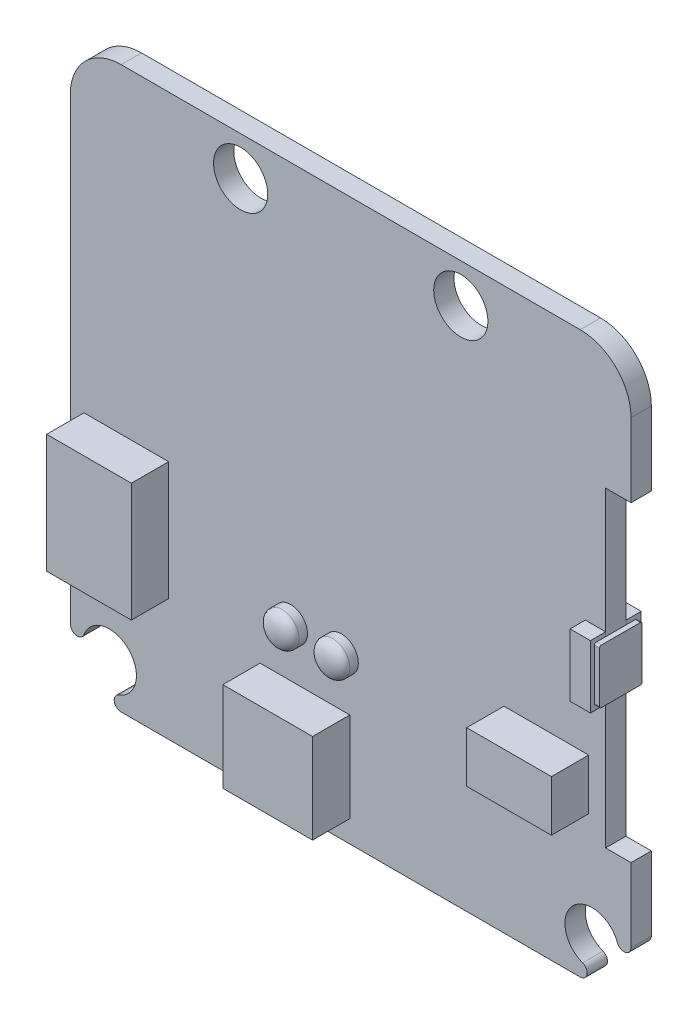
from build123d import *

# Parameters (mm, degrees)
EXTRUDE_1_DEPTH      = 1.2
CUT_EXTRUDE_START    = -1.2
SKETCH_2_R           = 1.6
CUT_EXTRUDE_1_DEPTH  = 1.2
SKETCH_3_W           = 1.5
SKETCH_3_H           = 18.4
CUT_EXTRUDE_2_DEPTH  = 1.2
EXTRUDE_2_DEPTH      = 0.9
EXTRUDE_2_DEPTH_BACK = 2.1
SKETCH_4_W           = 1.2
SKETCH_4_H           = 3.7
EXTRUDE_3_DEPTH      = 0.3
EXTRUDE_3_DEPTH_BACK = 0.5
SKETCH_6_W           = 5.3
SKETCH_6_H           = 5.3
EXTRUDE_4_DEPTH      = 2.2
SKETCH_6_W_2         = 5
SKETCH_6_H_2         = 7
EXTRUDE_4_2_DEPTH    = 2.2
SKETCH_6_H_3         = 3
EXTRUDE_4_3_DEPTH    = 2.2
SKETCH_7_R           = 1
EXTRUDE_5_DEPTH      = 0.5
EXTRUDE_5_2_DEPTH    = 0.5
DOME_1_FACE_RADIUS   = 1
DOME_1_HEIGHT        = 0.5
DOME_2_FACE_RADIUS   = 1
DOME_2_HEIGHT        = 0.5


with BuildPart() as part:
    # Эскиз1 → Бобышка-Вытянуть1 (new body)
    with BuildSketch(Plane.XY):
        with BuildLine():
            Line((-13.55, -16.55), (13.55, -16.55))
            ThreePointArc((13.55, -16.55), (15.671320344, -15.671320344), (16.55, -13.55))
            Line((16.55, -13.55), (16.55, 13.55))
            ThreePointArc((16.55, 13.55), (15.671320344, 15.671320344), (13.55, 16.55))
            Line((13.55, 16.55), (-13.55, 16.55))
            ThreePointArc((-13.55, 16.55), (-15.671320344, 15.671320344), (-16.55, 13.55))
            Line((-16.55, 13.55), (-16.55, -13.55))
            ThreePointArc((-16.55, -13.55), (-15.671320344, -15.671320344), (-13.55, -16.55))
        make_face()
    extrude(amount=EXTRUDE_1_DEPTH)

    # Эскиз2 → Вырез-Вытянуть1 (cut)
    with BuildSketch(Plane.XY.offset(1.2).offset(CUT_EXTRUDE_START)):
        with Locations((-6.5, 14.25)):
            Circle(SKETCH_2_R)
        with Locations((6.5, 14.25)):
            Circle(SKETCH_2_R)
        with BuildLine():
            ThreePointArc((-13.693566879, -15.750127389), (-13.11862915, -13.11862915), (-15.750127389, -13.693566879))
            ThreePointArc((-15.750127389, -13.693566879), (-16.210110036, -13.956327344), (-16.55, -13.55))
            ThreePointArc((-16.55, -13.55), (-15.671320344, -15.671320344), (-13.55, -16.55))
            ThreePointArc((-13.55, -16.55), (-13.956327344, -16.210110036), (-13.693566879, -15.750127389))
        make_face()
        with BuildLine():
            ThreePointArc((13.693566879, -15.750127389), (13.11862915, -13.11862915), (15.750127389, -13.693566879))
            ThreePointArc((15.750127389, -13.693566879), (16.210110036, -13.956327344), (16.55, -13.55))
            ThreePointArc((16.55, -13.55), (15.671320344, -15.671320344), (13.55, -16.55))
            ThreePointArc((13.55, -16.55), (13.956327344, -16.210110036), (13.693566879, -15.750127389))
        make_face()
    extrude(amount=CUT_EXTRUDE_1_DEPTH, mode=Mode.SUBTRACT)

    # Эскиз3 → Вырез-Вытянуть2 (cut)
    with BuildSketch(Plane.XY.offset(1.2)):
        with Locations((15.8, 0)):
            Rectangle(SKETCH_3_W, SKETCH_3_H)
    extrude(amount=-CUT_EXTRUDE_2_DEPTH, mode=Mode.SUBTRACT)


with BuildPart() as body_2:
    # Эскиз4 → Бобышка-Вытянуть2 (new, two sides: drawn at the far end of the back side and taken through both)
    with BuildSketch(Plane.XY.offset(1.2).offset(-EXTRUDE_2_DEPTH_BACK)):
        with Locations((14.45, 0)):
            Rectangle(SKETCH_4_W, SKETCH_4_H)
    extrude(amount=EXTRUDE_2_DEPTH + EXTRUDE_2_DEPTH_BACK)


with BuildPart() as body_3:
    # Эскиз5 → Бобышка-Вытянуть3 (new, two sides: drawn at the far end of the back side and taken through both)
    with BuildSketch(Plane(origin=(15.05, 0, 0), x_dir=(0, 0, -1), z_dir=(1, 0, 0)).offset(-EXTRUDE_3_DEPTH_BACK)):
        with BuildLine():
            Line((0.55, 1.6), (-1.75, 1.6))
            ThreePointArc((-1.75, 1.6), (-1.820710678, 1.570710678), (-1.85, 1.5))
            Line((-1.85, 1.5), (-1.85, -1.5))
            ThreePointArc((-1.85, -1.5), (-1.820710678, -1.570710678), (-1.75, -1.6))
            Line((-1.75, -1.6), (0.55, -1.6))
            ThreePointArc((0.55, -1.6), (0.620710678, -1.570710678), (0.65, -1.5))
            Line((0.65, -1.5), (0.65, 1.5))
            ThreePointArc((0.65, 1.5), (0.620710678, 1.570710678), (0.55, 1.6))
        make_face()
    extrude(amount=EXTRUDE_3_DEPTH + EXTRUDE_3_DEPTH_BACK)


with BuildPart() as body_4:
    # Эскиз6 → Бобышка-Вытянуть4 (new body)
    with BuildSketch(Plane.XY.offset(1.2)):
        with Locations((-2.7, -12.6)):
            Rectangle(SKETCH_6_W, SKETCH_6_H)
    extrude(amount=EXTRUDE_4_DEPTH)


with BuildPart() as body_5:
    # Эскиз6 → Extrude 4 2 (new body)
    with BuildSketch(Plane.XY.offset(1.2)):
        with Locations((-13.25, -5.85)):
            Rectangle(SKETCH_6_W_2, SKETCH_6_H_2)
    extrude(amount=EXTRUDE_4_2_DEPTH)


with BuildPart() as body_6:
    # Эскиз6 → Extrude 4 3 (new body)
    with BuildSketch(Plane.XY.offset(1.2)):
        with Locations((11.55, -6.45)):
            Rectangle(SKETCH_6_W_2, SKETCH_6_H_3)
    extrude(amount=EXTRUDE_4_3_DEPTH)


with BuildPart() as body_7:
    # Эскиз7 → Бобышка-Вытянуть5 (new body)
    with BuildSketch(Plane.XY.offset(1.2)):
        with Locations((-3.55, -7.05)):
            Circle(SKETCH_7_R)
    extrude(amount=EXTRUDE_5_DEPTH)

    # Купол2: an elliptical dome of height H over a round flat face of radius A is half a spheroid: the quarter ellipse of half axes A and H revolved about the face's axis
    with BuildSketch(Plane((-3.55, -7.05, 1.7), x_dir=(0, 1, 0), z_dir=(1, 0, 0)), mode=Mode.PRIVATE) as dome_2_quarter:
        Ellipse(DOME_2_FACE_RADIUS, DOME_2_HEIGHT)
        Rectangle(DOME_2_FACE_RADIUS, DOME_2_HEIGHT, align=(Align.MIN, Align.MIN), mode=Mode.INTERSECT)
    revolve(dome_2_quarter.sketch, axis=Axis((-3.55, -7.05, 1.7), (0, 0, 1)))


with BuildPart() as body_8:
    # Эскиз7 → Extrude 5 2 (new body)
    with BuildSketch(Plane.XY.offset(1.2)):
        with Locations((-0.55, -7.05)):
            Circle(SKETCH_7_R)
    extrude(amount=EXTRUDE_5_2_DEPTH)

    # Купол1: an elliptical dome of height H over a round flat face of radius A is half a spheroid: the quarter ellipse of half axes A and H revolved about the face's axis
    with BuildSketch(Plane((-0.55, -7.05, 1.7), x_dir=(0, 1, 0), z_dir=(1, 0, 0)), mode=Mode.PRIVATE) as dome_1_quarter:
        Ellipse(DOME_1_FACE_RADIUS, DOME_1_HEIGHT)
        Rectangle(DOME_1_FACE_RADIUS, DOME_1_HEIGHT, align=(Align.MIN, Align.MIN), mode=Mode.INTERSECT)
    revolve(dome_1_quarter.sketch, axis=Axis((-0.55, -7.05, 1.7), (0, 0, 1)))


solid = Compound([part.part, body_2.part, body_3.part, body_4.part, body_5.part, body_6.part, body_7.part, body_8.part])
